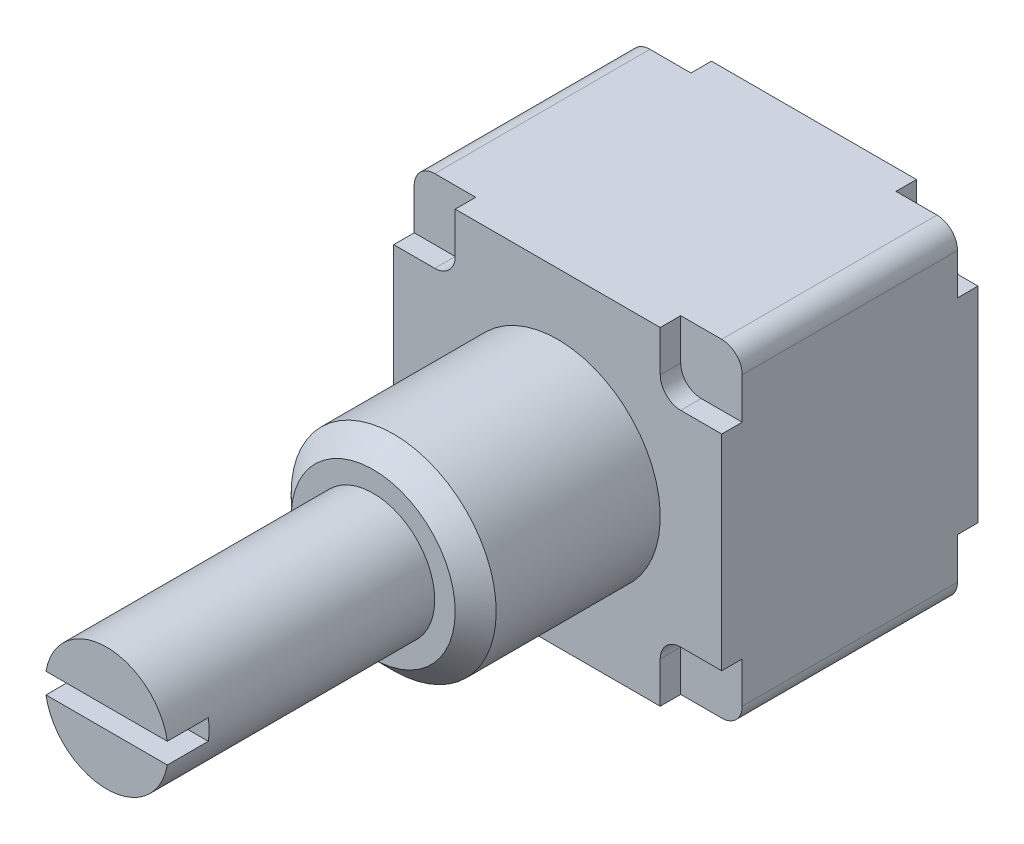
from build123d import *

# Parameters (mm, degrees)
ESQUISSE1_W             = 16
ESQUISSE1_H             = 16
EXTRUSION1_DEPTH        = 12.5
CONG_1_R                = 1
ESQUISSE2_R             = 5
EXTRUSION2_DEPTH        = 9
CHANFREIN1_SIZE         = 1
ESQUISSE3_R             = 3
EXTRUSION3_DEPTH        = 13
ESQUISSE4_W             = 6.995230525
ESQUISSE4_H             = 1
ENL_V_MAT_EXTRU_1_DEPTH = 2
ENL_V_MAT_EXTRU_2_DEPTH = 1
ENL_V_START             = -1
ENL_V_MAT_EXTRU_3_DEPTH = 1


with BuildPart() as part:
    # Esquisse1 → Extrusion1 (new body)
    with BuildSketch(Plane.XY):
        with Locations((8, 8)):
            Rectangle(ESQUISSE1_W, ESQUISSE1_H)
    extrude(amount=EXTRUSION1_DEPTH)

    # Congé1
    cong_1_edges = [part.edges().sort_by_distance(p)[0] for p in [
        (0, 16, 6.25),
        (16, 16, 6.25),
        (16, 0, 6.25),
        (0, 0, 6.25),
    ]]
    fillet(cong_1_edges, radius=CONG_1_R)

    # Esquisse2 → Extrusion2 (add)
    with BuildSketch(Plane.XY.offset(12.5)):
        with Locations(Location((8, 8, 0), (0, 0, 180))):
            Circle(ESQUISSE2_R)
    extrude(amount=EXTRUSION2_DEPTH)

    # Chanfrein1
    chanfrein1_edges = [part.edges().sort_by_distance(p)[0] for p in [
        (13, 8, 21.5),
    ]]
    chamfer(chanfrein1_edges, length=CHANFREIN1_SIZE)

    # Esquisse3 → Extrusion3 (add)
    with BuildSketch(Plane.XY.offset(21.5)):
        with Locations(Location((8, 8, 0), (0, 0, 180))):
            Circle(ESQUISSE3_R)
    extrude(amount=EXTRUSION3_DEPTH)

    # Esquisse4 → Enlèv. mat.-Extru.1 (cut)
    with BuildSketch(Plane.XY.offset(34.5)):
        with Locations((8.099931865, 8)):
            Rectangle(ESQUISSE4_W, ESQUISSE4_H)
    extrude(amount=-ENL_V_MAT_EXTRU_1_DEPTH, mode=Mode.SUBTRACT)

    # Esquisse5 → Enlèv. mat.-Extru.2 (cut)
    with BuildSketch(Plane.XY.offset(12.5)):
        with BuildLine():
            Line((13, 17.678512004), (13, 14))
            ThreePointArc((13, 14), (13.292893219, 13.292893219), (14, 13))
            Line((14, 13), (16.806932946, 13))
            Line((16.806932946, 13), (16.806932946, 17.678512004))
            Line((16.806932946, 17.678512004), (13, 17.678512004))
        make_face()
        with BuildLine():
            Line((-0.806932946, 17.678512004), (3, 17.678512004))
            Line((3, 17.678512004), (3, 14))
            ThreePointArc((3, 14), (2.707106781, 13.292893219), (2, 13))
            Line((2, 13), (-0.806932946, 13))
            Line((-0.806932946, 13), (-0.806932946, 17.678512004))
        make_face()
        with BuildLine():
            Line((16.806932946, -1.678512004), (13, -1.678512004))
            Line((13, -1.678512004), (13, 2))
            ThreePointArc((13, 2), (13.292893219, 2.707106781), (14, 3))
            Line((14, 3), (16.806932946, 3))
            Line((16.806932946, 3), (16.806932946, -1.678512004))
        make_face()
        with BuildLine():
            Line((3, -1.678512004), (3, 2))
            ThreePointArc((3, 2), (2.707106781, 2.707106781), (2, 3))
            Line((2, 3), (-0.806932946, 3))
            Line((-0.806932946, 3), (-0.806932946, -1.678512004))
            Line((-0.806932946, -1.678512004), (3, -1.678512004))
        make_face()
    extrude(amount=-ENL_V_MAT_EXTRU_2_DEPTH, mode=Mode.SUBTRACT)

    # Esquisse6 → Enlèv. mat.-Extru.3 (cut)
    with BuildSketch(Plane(origin=(0, 0, 0), x_dir=(-1, 0, 0), z_dir=(0, 0, -1)).offset(ENL_V_START)):
        with BuildLine():
            Line((0, 13), (0, 15))
            ThreePointArc((0, 15), (-0.292893219, 15.707106781), (-1, 16))
            Line((-1, 16), (-3, 16))
            Line((-3, 16), (-3, 14))
            ThreePointArc((-3, 14), (-2.707106781, 13.292893219), (-2, 13))
            Line((-2, 13), (0, 13))
        make_face()
        with BuildLine():
            Line((-13, 16), (-15, 16))
            ThreePointArc((-15, 16), (-15.707106781, 15.707106781), (-16, 15))
            Line((-16, 15), (-16, 13))
            Line((-16, 13), (-14, 13))
            ThreePointArc((-14, 13), (-13.292893219, 13.292893219), (-13, 14))
            Line((-13, 14), (-13, 16))
        make_face()
        with BuildLine():
            Line((-3, 0), (-1, 0))
            ThreePointArc((-1, 0), (-0.292893219, 0.292893219), (0, 1))
            Line((0, 1), (0, 3))
            Line((0, 3), (-2, 3))
            ThreePointArc((-2, 3), (-2.707106781, 2.707106781), (-3, 2))
            Line((-3, 2), (-3, 0))
        make_face()
        with BuildLine():
            Line((-15, 0), (-13, 0))
            Line((-13, 0), (-13, 2))
            ThreePointArc((-13, 2), (-13.292893219, 2.707106781), (-14, 3))
            Line((-14, 3), (-16, 3))
            Line((-16, 3), (-16, 1))
            ThreePointArc((-16, 1), (-15.707106781, 0.292893219), (-15, 0))
        make_face()
    extrude(amount=ENL_V_MAT_EXTRU_3_DEPTH, mode=Mode.SUBTRACT)


solid = part.part
